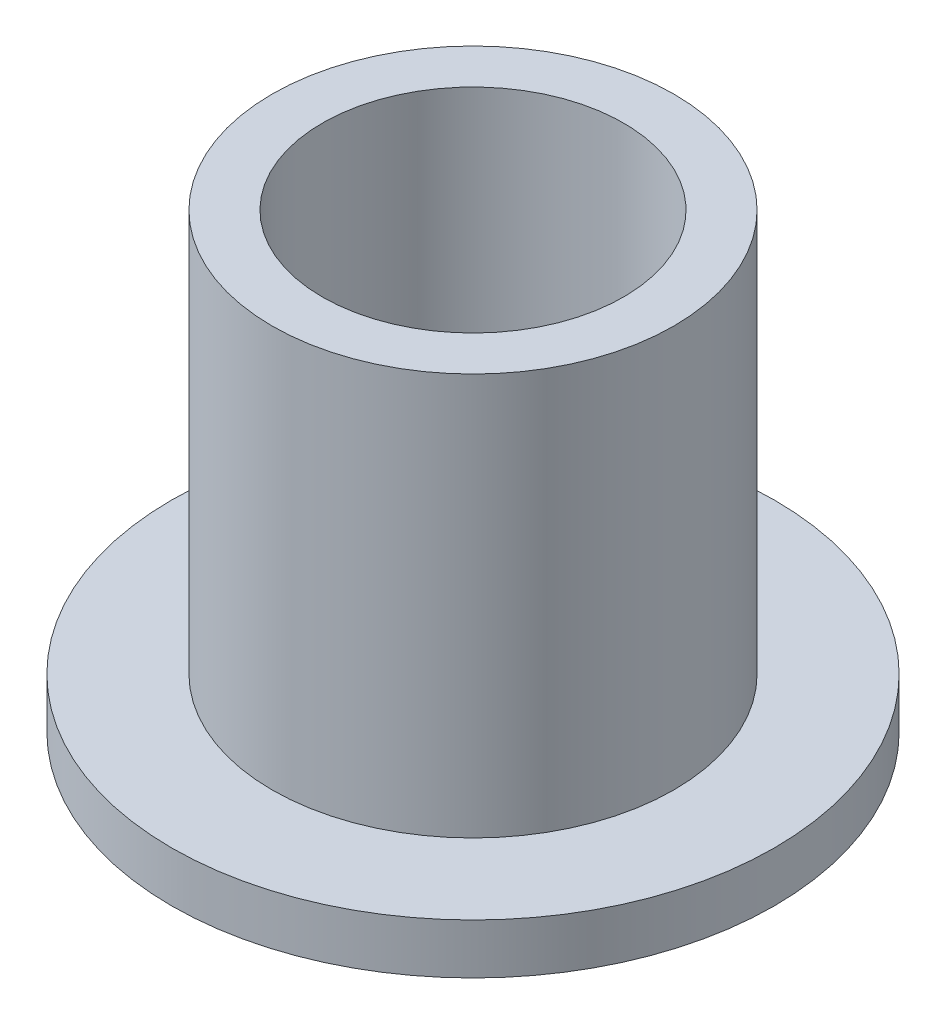
from build123d import *

# Parameters (mm, degrees)
SKETCH1_R           = 6
SKETCH1_R_2         = 3
BOSS_EXTRUDE1_DEPTH = 1
SKETCH2_R           = 4
SKETCH2_R_2         = 3
BOSS_EXTRUDE2_DEPTH = 8


with BuildPart() as part:
    # Sketch1 → Boss-Extrude1 (new body)
    with BuildSketch(Plane(origin=(0, 0, 0), x_dir=(1, 0, 0), z_dir=(0, 1, 0))):
        with Locations(Location((0, 0, 0), (0, 0, 270))):
            Circle(SKETCH1_R)
        with Locations(Location((0, 0, 0), (0, 0, 270))):
            Circle(SKETCH1_R_2, mode=Mode.SUBTRACT)
    extrude(amount=BOSS_EXTRUDE1_DEPTH)

    # Sketch2 → Boss-Extrude2 (add)
    with BuildSketch(Plane(origin=(0, 1, 0), x_dir=(-1, 0, 0), z_dir=(0, 1, 0))):
        with Locations(Location((0, 0, 0), (0, 0, 90))):
            Circle(SKETCH2_R)
        with Locations(Location((0, 0, 0), (0, 0, 90))):
            Circle(SKETCH2_R_2, mode=Mode.SUBTRACT)
    extrude(amount=BOSS_EXTRUDE2_DEPTH)


solid = part.part
